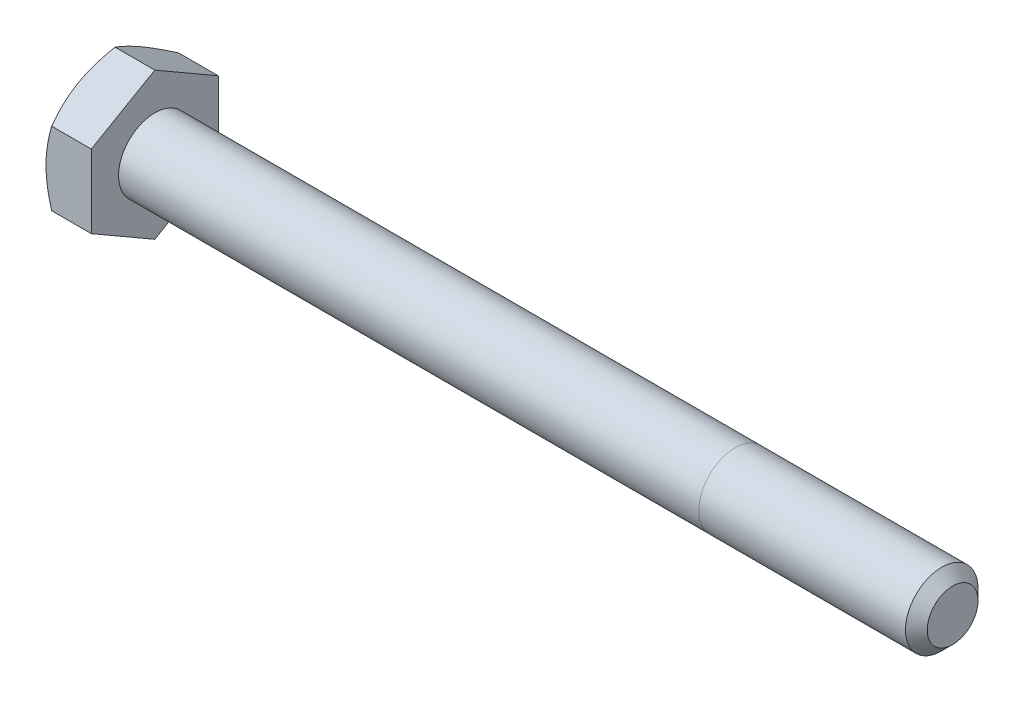
from build123d import *

# Parameters (mm, degrees)
SKETCH5_R           = 3.175
BOSS_EXTRUDE3_DEPTH = 69.85
CHAMFER1_SIZE       = 0.9525
BOSS_EXTRUDE4_DEPTH = 3.96875
SKETCH8_OUTSIDE_W   = 289.126
SKETCH8_OUTSIDE_H   = 290.846
SKETCH8_OUTSIDE_R   = 5.55625
CUT_EXTRUDE3_DEPTH  = 75.305062531
CUT_EXTRUDE3_DRAFT  = -60
CUT_EXTRUDE4_DEPTH  = 0.254
CIRPATTERN1_COUNT   = 3


with BuildPart() as part:
    # Sketch5 → Boss-Extrude3 (new body)
    with BuildSketch(Plane(origin=(36.909375, 0, 0), x_dir=(0, 0, -1), z_dir=(1, 0, 0))):
        Circle(SKETCH5_R)
    extrude(amount=-BOSS_EXTRUDE3_DEPTH)

    # Chamfer1
    chamfer1_edges = [part.edges().sort_by_distance(p)[0] for p in [
        (36.909375, 0, 3.175),
    ]]
    chamfer(chamfer1_edges, length=CHAMFER1_SIZE)

    # Sketch11 → Revolve1 (revolve)
    with BuildSketch(Plane.XY):
        Polygon((-32.940625, 3.175), (-32.940625, 0), (21.034375, 0), (17.859375, 3.175), align=None)
    revolve(axis=Axis((-32.940625, 0, 0), (1, 0, 0)))

    # Sketch6 → Boss-Extrude4 (add)
    with BuildSketch(Plane.ZY.offset(32.940625)):
        Polygon((5.55625, 3.207902433), (0, 6.415804866), (-5.55625, 3.207902433), (-5.55625, -3.207902433), (0, -6.415804866), (5.55625, -3.207902433), align=None)
    extrude(amount=BOSS_EXTRUDE4_DEPTH)


with BuildPart() as cut_extrude3_tool:
    # Sketch8 outside → Cut-Extrude3 (with draft: the straight prism first)
    with BuildSketch(Plane.ZY.offset(36.909375)):
        Rectangle(SKETCH8_OUTSIDE_W, SKETCH8_OUTSIDE_H)
        Circle(SKETCH8_OUTSIDE_R, mode=Mode.SUBTRACT)
    extrude(amount=-CUT_EXTRUDE3_DEPTH)
    # Cut-Extrude3: the draft: its side faces are tilted about the plane it starts from
    cut_extrude3_sides = [cut_extrude3_tool.faces().sort_by_distance(p)[0] for p in [
        (0.743156265, -145.423, 0),
        (0.743156265, 0, 144.563),
        (0.743156265, 145.423, 0),
        (0.743156265, 0, -144.563),
        (0.743156265, 0, -5.55625),
    ]]
    draft(cut_extrude3_sides, Plane.ZY.offset(36.909375), CUT_EXTRUDE3_DRAFT)


with BuildPart() as part_1:
    add(part.part)

    # Cut-Extrude3: cut by cut_extrude3_tool
    add(cut_extrude3_tool.part, mode=Mode.SUBTRACT)

    # Sketch12 → Cut-Extrude4 (cut)
    with BuildSketch(Plane.ZY.offset(36.909375)):
        with BuildLine():
            Line((0.1666875, 4.2783125), (0.1666875, 2.3891875))
            ThreePointArc((0.1666875, 2.3891875), (0, 2.2225), (-0.1666875, 2.3891875))
            Line((-0.1666875, 2.3891875), (-0.1666875, 4.2783125))
            ThreePointArc((-0.1666875, 4.2783125), (0, 4.445), (0.1666875, 4.2783125))
        make_face()
    cut_extrude4 = extrude(amount=-CUT_EXTRUDE4_DEPTH, mode=Mode.SUBTRACT)

    # CirPattern1: Cut-Extrude4 ×3 about axis
    cirpattern1_axis = Axis((0, 0, 0), (1, 0, 0))
    for i in range(1, CIRPATTERN1_COUNT):
        add(cut_extrude4.rotate(cirpattern1_axis, i * 360 / CIRPATTERN1_COUNT), mode=Mode.SUBTRACT)


solid = part_1.part
